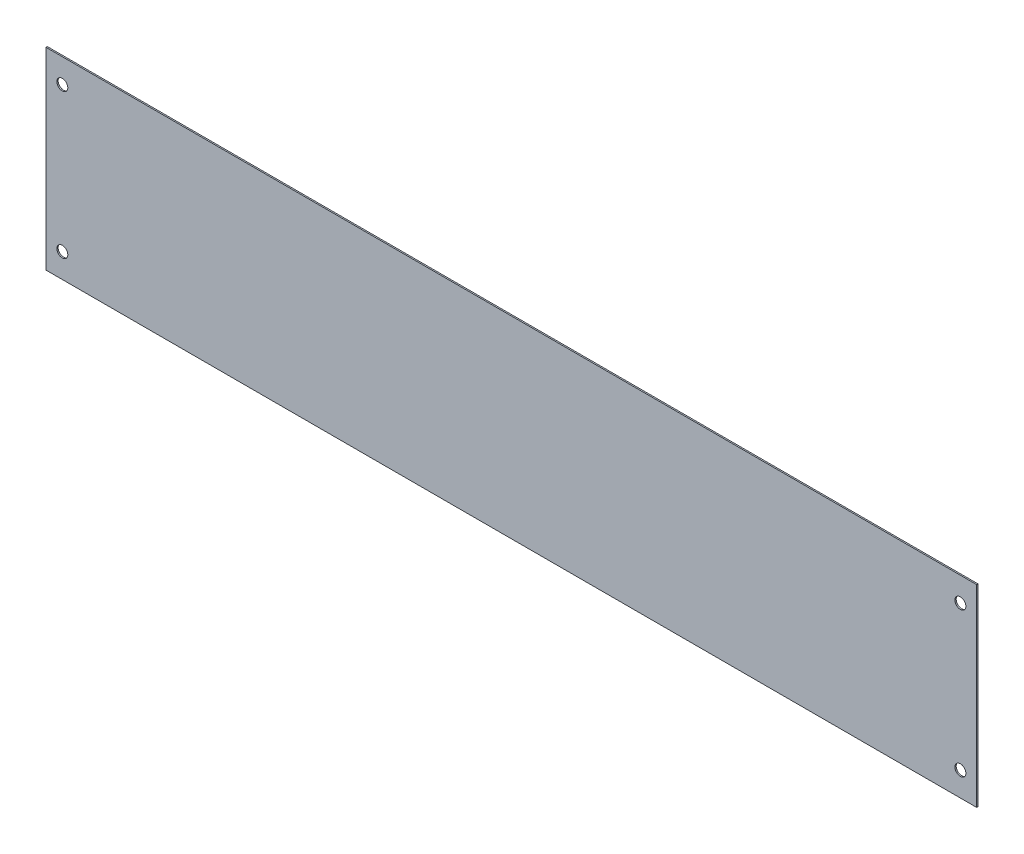
from build123d import *

# Parameters (mm, degrees)
SKETCH_1_W      = 424.9
SKETCH_1_H      = 88.1
SKETCH_1_R      = 2.5
EXTRUDE_1_DEPTH = 0.6


with BuildPart() as part:
    # Эскиз1 → Бобышка-Вытянуть1 (new body)
    with BuildSketch(Plane.XY):
        with Locations((241.1, 44.05)):
            Rectangle(SKETCH_1_W, SKETCH_1_H)
        with Locations((36.1, 11.05)):
            Circle(SKETCH_1_R, mode=Mode.SUBTRACT)
        with Locations((446.1, 11.05)):
            Circle(SKETCH_1_R, mode=Mode.SUBTRACT)
        with Locations((36.1, 77.05)):
            Circle(SKETCH_1_R, mode=Mode.SUBTRACT)
        with Locations((446.1, 77.05)):
            Circle(SKETCH_1_R, mode=Mode.SUBTRACT)
    extrude(amount=EXTRUDE_1_DEPTH)


solid = part.part
